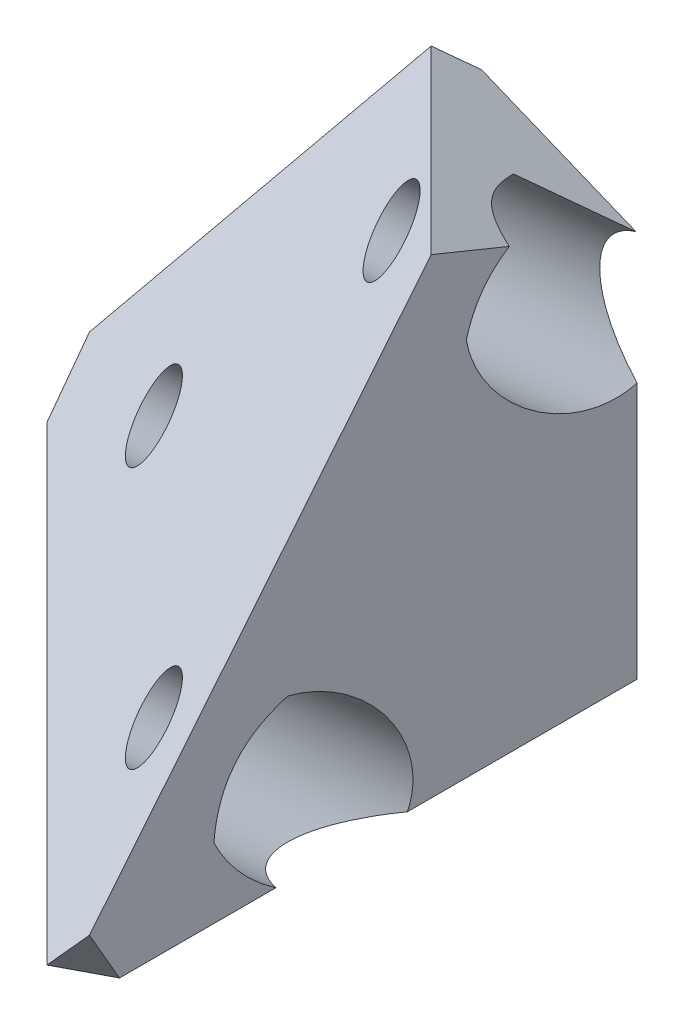
from build123d import *

# Parameters (mm, degrees)
BOSS_EXTRUDE1_DEPTH                            = 14
CUT_EXTRUDE1_DEPTH                             = 18.804493815
CUT_EXTRUDE1_DEPTH_BACK                        = 18.804493815
BOSS_EXTRUDE2_DEPTH                            = 2
CSK_FOR_M2_FLAT_HEAD_MACHINE_SCREW1_AT_2_COUNT = 2
CSK_FOR_M2_FLAT_HEAD_MACHINE_SCREW1_AT_2_PITCH = 11.412712211
CSK_FOR_M2_FLAT_HEAD_MACHINE_SCREW1_AT_3_COUNT = 2
CSK_FOR_M2_FLAT_HEAD_MACHINE_SCREW1_AT_3_PITCH = 11
M2X0_4_TAPPED_HOLE1_D                          = 1.6
M2X0_4_TAPPED_HOLE1_DEPTH                      = 3.5
M2X0_4_TAPPED_HOLE1_CSINK_D                    = 2.05
M2X0_4_TAPPED_HOLE1_CSINK_ANGLE                = 90
M2X0_4_TAPPED_HOLE1_TIP                        = 0.480688495
BOSS_EXTRUDE5_REACH                            = 20.765
SKETCH12_W                                     = 1.58113883
SKETCH12_H                                     = 18.073922282
CUT_EXTRUDE3_DEPTH                             = 20.541337939
CUT_EXTRUDE3_DEPTH_BACK                        = 20.541337939


with BuildPart() as part:
    # Sketch1 → Boss-Extrude1 (new body)
    with BuildSketch(Plane(origin=(0, 0, 0), x_dir=(1, 0, 0), z_dir=(0, 1, 0))):
        Polygon((-7.778174593, 7.778174593), (7.778174593, -7.778174593), (7.778174593, 7.778174593), align=None)
    extrude(amount=BOSS_EXTRUDE1_DEPTH)

    # Sketch2 → Cut-Extrude1 (cut, two sides: drawn at the far end of the back side and taken through both)
    with BuildSketch(Plane(origin=(0, 0, 0), x_dir=(0, -1, 0), z_dir=(-0.7071067811865476, 0, -0.7071067811865476)).offset(-CUT_EXTRUDE1_DEPTH_BACK)):
        Polygon((0, 0), (-14, -8.082903769), (-14, 0), align=None)
    extrude(amount=CUT_EXTRUDE1_DEPTH + CUT_EXTRUDE1_DEPTH_BACK, mode=Mode.SUBTRACT)

    # Sketch7 → Boss-Extrude2 (add)
    with BuildSketch(Plane(origin=(0, 0, -7.778174593), x_dir=(-1, 0, 0), z_dir=(0, 0, -1))):
        Polygon((-7.778174593, 0), (7.778174593, 0), (-3.65277754, 14), (-7.778174593, 14), align=None)
    extrude(amount=BOSS_EXTRUDE2_DEPTH)

    # Sketch4 → CSK for M2 Flat Head Machine Screw1 (revolve, cut)
    with BuildSketch(Plane(origin=(12.828546783, -2.102885683, -5.050372189), x_dir=(-0.048813033433799426, 0.7492053416010188, -0.6605366332638121), z_dir=(0.7890610165044198, 0.4343861831556179, 0.43438618315561783))):
        Polygon((0, 0), (0, 13.921032743), (1.2, 13.2), (1.2, 11), (2.2, 10), (2.2, 0), align=None)
    csk_for_m2_flat_head_machine_screw1 = revolve(axis=Axis((16.717111749, -5.277885683, -8.938937156), (-0.6123724356957967, 0.4999999999999948, 0.6123724356957967)), mode=Mode.SUBTRACT)

    # CSK for M2 Flat Head Machine Screw1 at 2: CSK for M2 Flat Head Machine Screw1 ×2
    with Locations(*[Vector(-0.030978910540443338, 0.7588252361140443, -0.6505571213492264) * (i * CSK_FOR_M2_FLAT_HEAD_MACHINE_SCREW1_AT_2_PITCH) for i in range(1, CSK_FOR_M2_FLAT_HEAD_MACHINE_SCREW1_AT_2_COUNT)]):
        add(csk_for_m2_flat_head_machine_screw1, mode=Mode.SUBTRACT)

    # CSK for M2 Flat Head Machine Screw1 at 3: CSK for M2 Flat Head Machine Screw1 ×2
    with Locations(*[Vector(-0.7071067811865477, 0, -0.7071067811865474) * (i * CSK_FOR_M2_FLAT_HEAD_MACHINE_SCREW1_AT_3_PITCH) for i in range(1, CSK_FOR_M2_FLAT_HEAD_MACHINE_SCREW1_AT_3_COUNT)]):
        add(csk_for_m2_flat_head_machine_screw1, mode=Mode.SUBTRACT)

    # M2x0.4 Tapped Hole1
    with Locations(Plane(origin=(0, 0, -9.778174593), x_dir=(-1, 0, 0), z_dir=(0, 0, -1))):
        with Locations((-2.778174593, 9.5), (-5.778174593, 1.5), (3.721825407, 1.5)):
            CounterSinkHole(M2X0_4_TAPPED_HOLE1_D / 2, M2X0_4_TAPPED_HOLE1_CSINK_D / 2, depth=M2X0_4_TAPPED_HOLE1_DEPTH, counter_sink_angle=M2X0_4_TAPPED_HOLE1_CSINK_ANGLE)
            with Locations((0, 0, -(M2X0_4_TAPPED_HOLE1_DEPTH + M2X0_4_TAPPED_HOLE1_TIP / 2))):  # 118° drill point
                Cone(0, M2X0_4_TAPPED_HOLE1_D / 2, M2X0_4_TAPPED_HOLE1_TIP, mode=Mode.SUBTRACT)

    # Boss-Extrude5: up to this face of the body (flat: up to its plane)
    boss_extrude5_end = Plane(part.part.faces().sort_by_distance((-2.062698527, 7, -8.778174593))[0])
    # Sketch12 → Boss-Extrude5 (add, up to the picked face)
    with BuildSketch(Plane(origin=(0, 0, 0), x_dir=(0.4743416490252608, -0.3872983346207397, 0.7905694150420935), z_dir=(-0.6123724356957969, 0.4999999999999949, 0.6123724356957962)), mode=Mode.PRIVATE) as boss_extrude5_sk1:
        with Locations((-10.629268516, 4.117611591)):
            Rectangle(SKETCH12_W, SKETCH12_H)
    boss_extrude5_tool1 = split(extrude(boss_extrude5_sk1.sketch, amount=-BOSS_EXTRUDE5_REACH, mode=Mode.PRIVATE), bisect_by=boss_extrude5_end, keep=Keep.BOTH, mode=Mode.PRIVATE)
    add(boss_extrude5_tool1.solids().sort_by(Axis((-2.437699, 7.306186, -8.403175), (0.6123724356957969, -0.4999999999999949, -0.6123724356957962)))[0])

    # Sketch9 → Cut-Extrude3 (cut, two sides: drawn at the far end of the back side and taken through both)
    with BuildSketch(Plane(origin=(0, 0, 0), x_dir=(0.4743416490252609, -0.3872983346207397, 0.7905694150420934), z_dir=(-0.6123724356957968, 0.49999999999999495, 0.6123724356957964)).offset(-CUT_EXTRUDE3_DEPTH_BACK)):
        Polygon((8.238699101, 6.11934955), (8.049844719, 4.024922359), (9.838699101, 4.91934955), align=None)
        Polygon((-9.630983549, -4.815491775), (-11.419837931, -5.709918966), (-11.419837931, -3.709918966), align=None)
        Polygon((-4.620438725, 15.76370292), (-11.419837931, 12.364003317), (-11.419837931, 20.863252325), align=None)
    extrude(amount=CUT_EXTRUDE3_DEPTH + CUT_EXTRUDE3_DEPTH_BACK, mode=Mode.SUBTRACT)


solid = part.part
